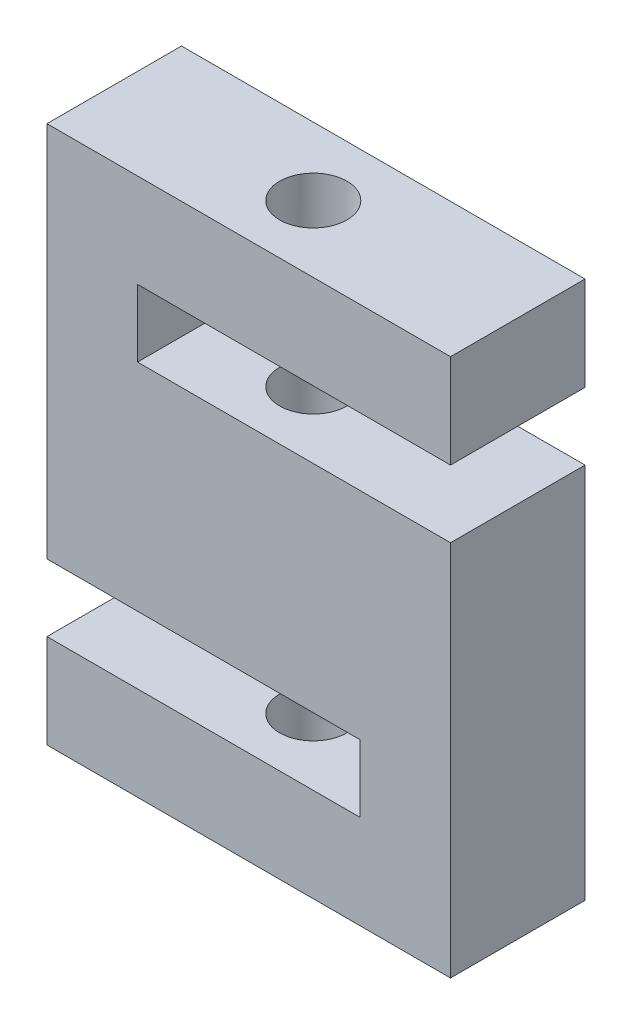
from build123d import *

# Parameters (mm, degrees)
BOSS_EXTRUDE1_DEPTH = 20
SKETCH2_R           = 5
CUT_EXTRUDE1_DEPTH  = 102.980390272


with BuildPart() as part:
    # Sketch1 → Boss-Extrude1 (new body)
    with BuildSketch(Plane.XY):
        Polygon((0, 80), (60, 80), (60, 66.042717231), (13.470274345, 66.042717231), (13.470274345, 56.042717231), (60, 56.042717231), (60, 0), (0, 0), (0, 13.957282769), (46.529725655, 13.957282769), (46.529725655, 23.957282769), (0, 23.957282769), align=None)
    extrude(amount=BOSS_EXTRUDE1_DEPTH)

    # Sketch2 → Cut-Extrude1 (cut, through all)
    with BuildSketch(Plane(origin=(0, 80, 0), x_dir=(1, 0, 0), z_dir=(0, 1, 0))):
        with Locations(Location((29.69741662, -10.100861127, 0), (0, 0, 270))):
            Circle(SKETCH2_R)
    extrude(amount=-CUT_EXTRUDE1_DEPTH, mode=Mode.SUBTRACT)


solid = part.part
